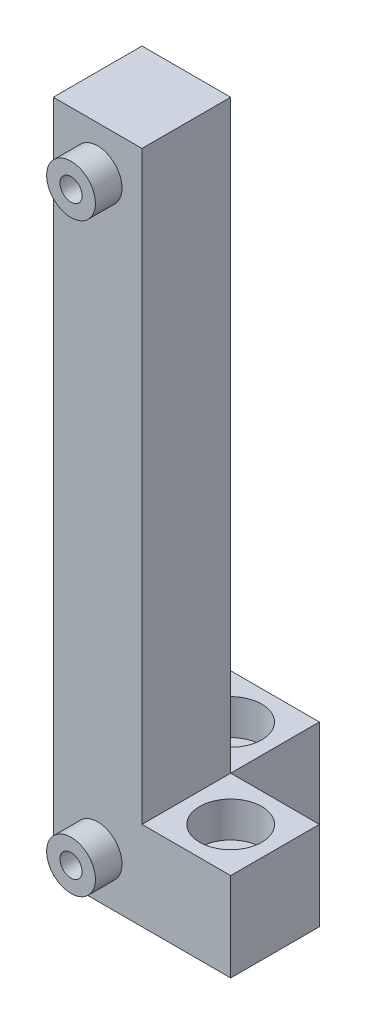
from build123d import *

# Parameters (mm, degrees)
BOSS_EXTRU_1_DEPTH      = 10
ESQUISSE2_R             = 2.75
BOSS_EXTRU_2_DEPTH      = 3
ESQUISSE3_R             = 1.25
ENL_V_MAT_EXTRU_1_DEPTH = 8
ESQUISSE4_W             = 10
ESQUISSE4_H             = 10
BOSS_EXTRU_3_DEPTH      = 10
ENL_V_MAT_EXTRU_2_REACH = 72.178
ESQUISSE5_R             = 1.75
ESQUISSE6_R             = 3.5
ENL_V_MAT_EXTRU_3_DEPTH = 4


with BuildPart() as part:
    # Esquisse1 → Boss.-Extru.1 (new body)
    with BuildSketch(Plane.XY):
        Polygon((0, 76), (10, 76), (10, 10), (20, 10), (20, 0), (0, 0), align=None)
    extrude(amount=BOSS_EXTRU_1_DEPTH)

    # Esquisse2 → Boss.-Extru.2 (add)
    with BuildSketch(Plane.XY.offset(10)):
        with Locations(Location((5, 71, 0), (0, 0, 180))):
            Circle(ESQUISSE2_R)
        with Locations(Location((5, 5, 0), (0, 0, 180))):
            Circle(ESQUISSE2_R)
    extrude(amount=BOSS_EXTRU_2_DEPTH)

    # Esquisse3 → Enlèv. mat.-Extru.1 (cut)
    with BuildSketch(Plane.XY.offset(13)):
        with Locations((5, 71)):
            Circle(ESQUISSE3_R)
        with Locations((5, 5)):
            Circle(ESQUISSE3_R)
    extrude(amount=-ENL_V_MAT_EXTRU_1_DEPTH, mode=Mode.SUBTRACT)

    # Esquisse4 → Boss.-Extru.3 (add)
    with BuildSketch(Plane(origin=(0, 0, 0), x_dir=(-1, 0, 0), z_dir=(0, 0, -1))):
        with Locations((-5, 5)):
            Rectangle(ESQUISSE4_W, ESQUISSE4_H)
    extrude(amount=BOSS_EXTRU_3_DEPTH)

    # Esquisse5 → Enlèv. mat.-Extru.2 (cut, up to next)
    with BuildSketch(Plane(origin=(0, 10, 0), x_dir=(1, 0, 0), z_dir=(0, 1, 0)), mode=Mode.PRIVATE) as enl_v_mat_extru_2_sk1:
        with Locations(Location((15, -5, 0), (0, 0, 270))):
            Circle(ESQUISSE5_R)
    enl_v_mat_extru_2_tool1 = extrude(enl_v_mat_extru_2_sk1.sketch, amount=-ENL_V_MAT_EXTRU_2_REACH, mode=Mode.PRIVATE) & part.part
    # Esquisse5 → Enlèv. mat.-Extru.2 (cut, up to next)
    with BuildSketch(Plane(origin=(0, 10, 0), x_dir=(1, 0, 0), z_dir=(0, 1, 0)), mode=Mode.PRIVATE) as enl_v_mat_extru_2_sk2:
        with Locations(Location((5, 5, 0), (0, 0, 270))):
            Circle(ESQUISSE5_R)
    enl_v_mat_extru_2_tool2 = extrude(enl_v_mat_extru_2_sk2.sketch, amount=-ENL_V_MAT_EXTRU_2_REACH, mode=Mode.PRIVATE) & part.part
    add(enl_v_mat_extru_2_tool1.solids().sort_by_distance((15, 10, 5))[0], mode=Mode.SUBTRACT)
    add(enl_v_mat_extru_2_tool2.solids().sort_by_distance((5, 10, -5))[0], mode=Mode.SUBTRACT)

    # Esquisse6 → Enlèv. mat.-Extru.3 (cut)
    with BuildSketch(Plane(origin=(0, 10, 0), x_dir=(1, 0, 0), z_dir=(0, 1, 0))):
        with Locations(Location((15, -5, 0), (0, 0, 270))):
            Circle(ESQUISSE6_R)
        with Locations(Location((5, 5, 0), (0, 0, 270))):
            Circle(ESQUISSE6_R)
    extrude(amount=-ENL_V_MAT_EXTRU_3_DEPTH, mode=Mode.SUBTRACT)


solid = part.part
